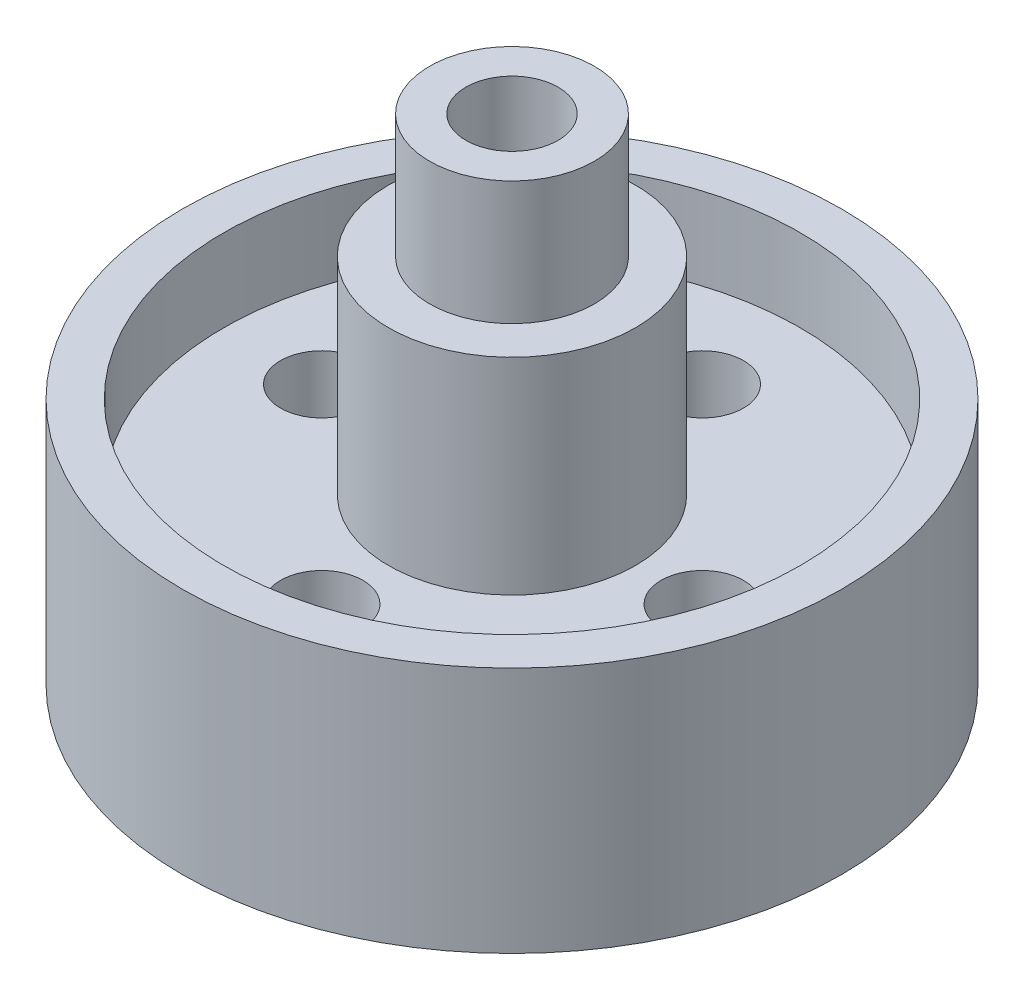
from build123d import *

# Parameters (mm, degrees)
SKETCH2_R          = 280
CUT_EXTRUDE1_DEPTH = 4124.105625618
SKETCH3_R          = 250
CUT_EXTRUDE2_DEPTH = 3465.101615138
CIRPATTERN1_COUNT  = 4


with BuildPart() as part:
    # Sketch1 → Revolve1 (revolve)
    with BuildSketch(Plane.XY):
        Polygon((0, 0), (2000, 0), (2000, 1500), (1750, 1500), (1750, 1000), (750, 1000), (750, 2250), (500, 2250), (500, 3000), (0, 3000), align=None)
    revolve(axis=Axis((0, 0, 0), (0, 1, 0)))

    # Sketch2 → Cut-Extrude1 (cut, through all)
    with BuildSketch(Plane(origin=(0, 3000, 0), x_dir=(1, 0, 0), z_dir=(0, 1, 0))):
        with Locations(Location((0, 0, 0), (0, 0, 180))):
            Circle(SKETCH2_R)
    extrude(amount=-CUT_EXTRUDE1_DEPTH, mode=Mode.SUBTRACT)

    # Sketch3 → Cut-Extrude2 (cut, through all)
    with BuildSketch(Plane(origin=(0, 1000, 0), x_dir=(1, 0, 0), z_dir=(0, 1, 0))):
        with Locations(Location((1155, 0, 0), (0, 0, 180))):
            Circle(SKETCH3_R)
    cut_extrude2 = extrude(amount=-CUT_EXTRUDE2_DEPTH, mode=Mode.SUBTRACT)

    # CirPattern1: Cut-Extrude2 ×4 about axis
    cirpattern1_axis = Axis((0, 0, 0), (0, 1, 0))
    for i in range(1, CIRPATTERN1_COUNT):
        add(cut_extrude2.rotate(cirpattern1_axis, i * 360 / CIRPATTERN1_COUNT), mode=Mode.SUBTRACT)


solid = part.part
